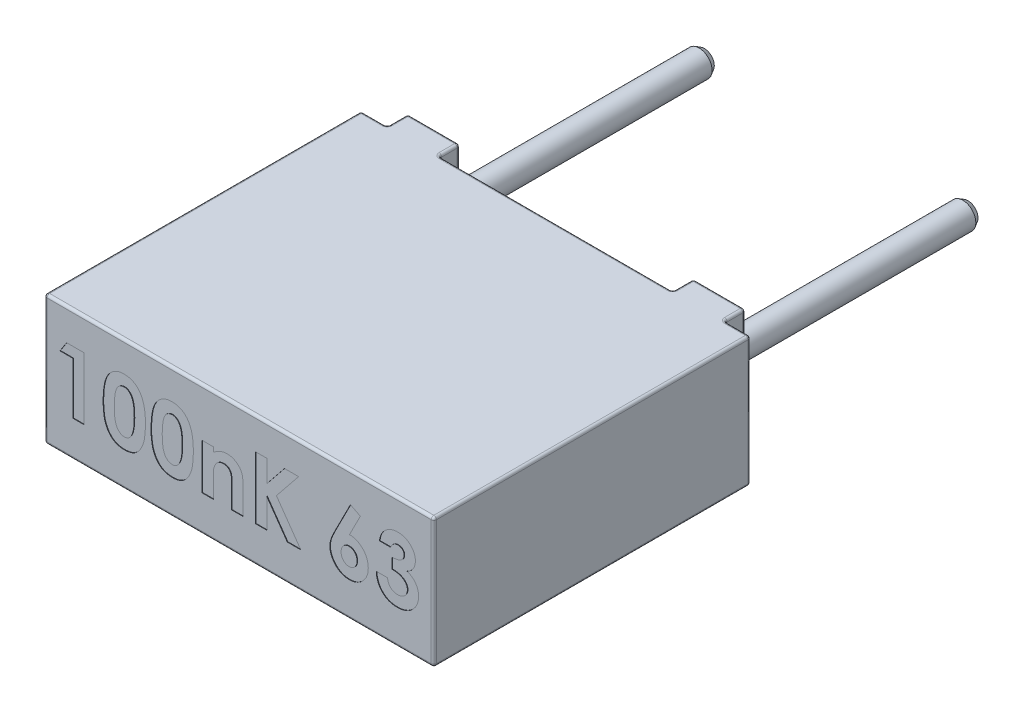
from build123d import *

# Parameters (mm, degrees)
CROQUIS1_W                = 7.5
CROQUIS1_H                = 2.5
SALIENTE_EXTRUIR1_DEPTH   = 6.5
CROQUIS2_W                = 0.5
CROQUIS2_H                = 0.4
CROQUIS2_W_2              = 4.5
CORTAR_EXTRUIR1_DEPTH     = 8.90964601
REDONDEO1_R               = 0.05
CROQUIS3_R                = 0.25
SALIENTE_EXTRUIR2_DEPTH   = 5
SALIENTE_EXTRUIR2_2_DEPTH = 5
CHAFL_N1_SIZE             = 0.1
CHAFL_N1_SIZE2            = 0.057735027
CHAFL_N2_SIZE             = 0.1
CHAFL_N2_SIZE2            = 0.057735027
CORTAR_EXTRUIR2_DEPTH     = 0.01


with BuildPart() as part:
    # Croquis1 → Saliente-Extruir1 (new body)
    with BuildSketch(Plane.XY):
        Rectangle(CROQUIS1_W, CROQUIS1_H)
    extrude(amount=SALIENTE_EXTRUIR1_DEPTH)

    # Croquis2 → Cortar-Extruir1 (cut, through all)
    with BuildSketch(Plane.XZ.offset(1.25)):
        with Locations((-3.5, 0.2)):
            Rectangle(CROQUIS2_W, CROQUIS2_H)
        with Locations((0, 0.2)):
            Rectangle(CROQUIS2_W_2, CROQUIS2_H)
        with Locations((3.5, 0.2)):
            Rectangle(CROQUIS2_W, CROQUIS2_H)
    extrude(amount=-CORTAR_EXTRUIR1_DEPTH, mode=Mode.SUBTRACT)

    # Redondeo1
    redondeo1_edges = [part.edges().sort_by_distance(p)[0] for p in [
        (-3.75, 0, 6.5),
        (0, -1.25, 6.5),
        (-2.75, -1.25, 0),
        (2.75, -1.25, 0),
        (2.75, 1.25, 0),
        (-2.75, 1.25, 0),
        (-3.5, 1.25, 0.4),
        (-3.75, 0, 0.4),
        (-3.25, 1.25, 0.2),
        (-3.25, 0, 0.4),
        (-3.25, 0, 0),
        (-3.25, -1.25, 0.2),
        (-3.5, -1.25, 0.4),
        (3.5, 1.25, 0.4),
        (3.25, 0, 0.4),
        (3.75, 0, 0.4),
        (3.25, 1.25, 0.2),
        (3.25, 0, 0),
        (3.5, -1.25, 0.4),
        (3.25, -1.25, 0.2),
        (-2.25, 1.25, 0.2),
        (-2.25, 0, 0),
        (0, 1.25, 0.4),
        (-2.25, 0, 0.4),
        (2.25, 1.25, 0.2),
        (2.25, 0, 0.4),
        (2.25, 0, 0),
        (-2.25, -1.25, 0.2),
        (3.75, 0, 6.5),
        (2.25, -1.25, 0.2),
        (0, -1.25, 0.4),
        (0, 1.25, 6.5),
        (3.75, -1.25, 3.45),
        (-3.75, -1.25, 3.45),
        (-3.75, 1.25, 3.45),
        (3.75, 1.25, 3.45),
    ]]
    fillet(redondeo1_edges, radius=REDONDEO1_R)

    # Croquis4 → Cortar-Extruir2 (cut)
    # profile 1 of 7: a face of its own
    with BuildSketch(Plane.XY.offset(6.5)):
        Polygon((-3.322811011, 0.642041721), (-2.989878319, 0.642041721), (-2.989878319, -0.557958279), (-3.205262934, -0.557958279), (-3.205262934, 0.442041721), (-3.45141678, 0.442041721), align=None)
    # profile 2 of 7: a face of its own
    with BuildSketch(Plane.XY.offset(6.5)):
        with BuildLine():
            add(Edge.make_bspline(
                [(-2.216561011, 0.672810952), (-2.206135502, 0.672656182), (-2.185636165, 0.672351864), (-2.1554445, 0.669055847), (-2.12636158, 0.664076485), (-2.098273628, 0.657132012), (-2.071382824, 0.647941249), (-2.045493451, 0.636940063), (-2.020913667, 0.62355142), (-1.997330003, 0.60842826), (-1.974751542, 0.591306698), (-1.953720942, 0.571787234), (-1.933854139, 0.550319011), (-1.915581177, 0.526577468), (-1.898497395, 0.50077856), (-1.882658927, 0.472918195), (-1.868187022, 0.442860016), (-1.854919483, 0.41054978), (-1.843055608, 0.375503172), (-1.833062681, 0.337318191), (-1.824492074, 0.295986116), (-1.817257877, 0.251404067), (-1.811789993, 0.203512783), (-1.808104529, 0.15234408), (-1.805575389, 0.097996605), (-1.805368979, 0.060714683), (-1.805262934, 0.041560952)],
                knots=[0, 0, 0, 0, 0.879237366, 1.728815576, 2.559023295, 3.367336655, 4.166867292, 4.954216142, 5.737608147, 6.525189134, 7.316157332, 8.124696809, 8.942788509, 9.781158001, 10.649253743, 11.551476218, 12.482711956, 13.461909668, 14.496590415, 15.601789533, 16.789733467, 18.056700938, 19.410929216, 20.8549011, 22.384193279, 24, 24, 24, 24], degree=3))
            add(Edge.make_bspline(
                [(-1.805262934, 0.041560952), (-1.80537754, 0.022167585), (-1.805600215, -0.015513377), (-1.807999392, -0.070357942), (-1.812130887, -0.12189816), (-1.817455857, -0.170128699), (-1.824749608, -0.21502409), (-1.833291604, -0.25670058), (-1.843442267, -0.295143064), (-1.855696934, -0.330264922), (-1.868884164, -0.362631902), (-1.883395657, -0.392631474), (-1.898978478, -0.420344896), (-1.915275204, -0.44619026), (-1.933179284, -0.46940566), (-1.951819273, -0.490780541), (-1.972006792, -0.509500704), (-1.992891867, -0.526530905), (-2.015239603, -0.541248416), (-2.038819533, -0.554120108), (-2.064052048, -0.564560579), (-2.090477201, -0.573641144), (-2.118545414, -0.580160009), (-2.147810687, -0.585332515), (-2.178603419, -0.588191158), (-2.199568351, -0.588545792), (-2.210311011, -0.58872751)],
                knots=[0, 0, 0, 0, 1.643780988, 3.193836972, 4.651895693, 6.025988579, 7.305620092, 8.505800249, 9.631074763, 10.672816429, 11.65661981, 12.592235626, 13.49536222, 14.350718032, 15.179365177, 15.97804903, 16.751647189, 17.51006938, 18.259804725, 19.016521909, 19.783502495, 20.571750527, 21.382245291, 22.22305063, 23.089471752, 24, 24, 24, 24], degree=3))
            add(Edge.make_bspline(
                [(-2.210311011, -0.58872751), (-2.221053381, -0.588542287), (-2.242097526, -0.588179437), (-2.272973525, -0.58535377), (-2.30239389, -0.580139055), (-2.330684167, -0.573591097), (-2.357647462, -0.564580671), (-2.383413063, -0.553827828), (-2.407782853, -0.541036449), (-2.430824311, -0.526284648), (-2.452458765, -0.509368392), (-2.473022415, -0.49046862), (-2.492469772, -0.469633239), (-2.510504995, -0.446628874), (-2.527423447, -0.421762586), (-2.543048697, -0.394750414), (-2.557371354, -0.365631687), (-2.570839433, -0.334365816), (-2.582541488, -0.300279684), (-2.592955775, -0.263068905), (-2.601486884, -0.222423296), (-2.608348173, -0.178355917), (-2.613826223, -0.130960124), (-2.617901262, -0.080213043), (-2.620313764, -0.026091035), (-2.620534105, 0.011109717), (-2.62064755, 0.030262875)],
                knots=[0, 0, 0, 0, 0.917216111, 1.796812873, 2.643793957, 3.46689424, 4.273913431, 5.068098542, 5.848489301, 6.620921603, 7.401012384, 8.190319798, 9.003608147, 9.831726257, 10.68377682, 11.569763213, 12.493818149, 13.453288342, 14.474581811, 15.568529029, 16.750744269, 18.018426408, 19.375425659, 20.823733699, 22.36466933, 24, 24, 24, 24], degree=3))
            add(Edge.make_bspline(
                [(-2.62064755, 0.030262875), (-2.620442056, 0.05687468), (-2.620045552, 0.108222501), (-2.615020768, 0.182405173), (-2.607645659, 0.250974203), (-2.596813372, 0.313814892), (-2.583419398, 0.371159983), (-2.566267717, 0.422631717), (-2.546741776, 0.468942321), (-2.530103166, 0.496377002), (-2.522089857, 0.509589798)],
                knots=[0, 0, 0, 0, 1.288568992, 2.486310467, 3.599230591, 4.627010532, 5.572937695, 6.447898582, 7.252493626, 8, 8, 8, 8], degree=3))
            add(Edge.make_bspline(
                [(-2.522089857, 0.509589798), (-2.512772364, 0.522570044), (-2.494554829, 0.547948983), (-2.462700959, 0.581266786), (-2.428478124, 0.609761803), (-2.391183404, 0.632789165), (-2.351406633, 0.650948545), (-2.308806306, 0.663774311), (-2.26353974, 0.6712472), (-2.232454433, 0.672281917), (-2.216561011, 0.672810952)],
                knots=[0, 0, 0, 0, 1.058512271, 2.069600068, 3.047294572, 4.004278952, 4.967380941, 5.939006123, 6.946246673, 8, 8, 8, 8], degree=3))
        make_face()
        with BuildLine():
            add(Edge.make_bspline(
                [(-2.21127255, 0.457426336), (-2.220697297, 0.456979622), (-2.239174803, 0.456103825), (-2.265986546, 0.448669543), (-2.291268346, 0.437186894), (-2.310499535, 0.423369322), (-2.324893889, 0.410123521), (-2.334951328, 0.398136503), (-2.344650142, 0.384759854), (-2.353216623, 0.369389956), (-2.361305618, 0.352579066), (-2.369211003, 0.334250874), (-2.375691344, 0.3139552), (-2.382058107, 0.292037681), (-2.387635985, 0.267892357), (-2.392309024, 0.241321866), (-2.396483973, 0.212153417), (-2.399396051, 0.180367906), (-2.40211098, 0.145998587), (-2.404057171, 0.108968899), (-2.404870824, 0.069288833), (-2.40512946, 0.04196176), (-2.405262934, 0.027859029)],
                knots=[0, 0, 0, 0, 1.076674018, 2.110852608, 3.161083442, 4.239746716, 4.804137807, 5.395870207, 6.026861976, 6.692161227, 7.405688833, 8.16177676, 8.973626916, 9.841385931, 10.773283133, 11.807421078, 12.927755683, 14.143907515, 15.458935494, 16.872852025, 18.386167141, 20, 20, 20, 20], degree=3))
            add(Edge.make_bspline(
                [(-2.405262934, 0.027859029), (-2.405043251, 0.009588258), (-2.404621993, -0.025447299), (-2.402415639, -0.075829649), (-2.397993186, -0.121681646), (-2.392492546, -0.163314043), (-2.384766674, -0.200456844), (-2.375877558, -0.233461455), (-2.36490029, -0.261907147), (-2.352213941, -0.286205308), (-2.338163238, -0.306875703), (-2.322910583, -0.324445632), (-2.306975272, -0.339660361), (-2.289859913, -0.352019098), (-2.271605339, -0.361490265), (-2.252363942, -0.368302758), (-2.232123493, -0.372472969), (-2.218263042, -0.373051243), (-2.21127255, -0.373342895)],
                knots=[0, 0, 0, 0, 1.771748488, 3.397459088, 4.888034009, 6.237357457, 7.467047327, 8.564189669, 9.548206622, 10.417051504, 11.216568818, 11.965764335, 12.669334354, 13.348544111, 14.005342236, 14.656555988, 15.322436492, 16, 16, 16, 16], degree=3))
            add(Edge.make_bspline(
                [(-2.21127255, -0.373342895), (-2.204521948, -0.373143325), (-2.191305111, -0.372752592), (-2.172032001, -0.368741776), (-2.15380598, -0.362221059), (-2.136682076, -0.352997047), (-2.12059904, -0.341267304), (-2.105635476, -0.326980285), (-2.091904235, -0.309993582), (-2.083904353, -0.297386937), (-2.079782165, -0.290890971)],
                knots=[0, 0, 0, 0, 0.992283464, 1.942767638, 2.88273346, 3.832339453, 4.79467288, 5.803907806, 6.868395428, 8, 8, 8, 8], degree=3))
            add(Edge.make_bspline(
                [(-2.079782165, -0.290890971), (-2.074928983, -0.282014443), (-2.064752255, -0.263401082), (-2.052975727, -0.23199173), (-2.043062903, -0.196567173), (-2.03453108, -0.157017164), (-2.028695833, -0.113185716), (-2.023670526, -0.065350766), (-2.021246695, -0.013271436), (-2.020852446, 0.022809311), (-2.02064755, 0.041560952)],
                knots=[0, 0, 0, 0, 0.710965849, 1.490837728, 2.352621235, 3.297892224, 4.334225155, 5.461620853, 6.680770821, 8, 8, 8, 8], degree=3))
            add(Edge.make_bspline(
                [(-2.02064755, 0.041560952), (-2.020726697, 0.060475366), (-2.020879041, 0.096882384), (-2.023674125, 0.149148942), (-2.027566492, 0.196885769), (-2.033259902, 0.239986286), (-2.040585509, 0.278555125), (-2.049614346, 0.312589762), (-2.060258674, 0.342157275), (-2.072881579, 0.36722818), (-2.08686223, 0.38853501), (-2.101703118, 0.406814617), (-2.117466996, 0.422421284), (-2.134127502, 0.435413743), (-2.152070248, 0.445340956), (-2.170952506, 0.452350389), (-2.190812986, 0.456590861), (-2.204360644, 0.457144086), (-2.21127255, 0.457426336)],
                knots=[0, 0, 0, 0, 1.793836731, 3.452829483, 4.963243077, 6.335886805, 7.574563692, 8.684454726, 9.672768357, 10.54971625, 11.340229787, 12.085688095, 12.778991901, 13.440269426, 14.083255152, 14.715733572, 15.344777694, 16, 16, 16, 16], degree=3))
        make_face(mode=Mode.SUBTRACT)
    # profile 3 of 7: a face of its own
    with BuildSketch(Plane.XY.offset(6.5)):
        with BuildLine():
            add(Edge.make_bspline(
                [(-1.293484088, 0.672810952), (-1.283058579, 0.672656182), (-1.262559242, 0.672351864), (-1.232367577, 0.669055847), (-1.203284657, 0.664076485), (-1.175196705, 0.657132012), (-1.148305901, 0.647941249), (-1.122416528, 0.636940063), (-1.097836744, 0.62355142), (-1.07425308, 0.60842826), (-1.051674619, 0.591306698), (-1.030644019, 0.571787234), (-1.010777216, 0.550319011), (-0.992504254, 0.526577468), (-0.975420472, 0.50077856), (-0.959582004, 0.472918195), (-0.945110099, 0.442860016), (-0.93184256, 0.41054978), (-0.919978685, 0.375503172), (-0.909985758, 0.337318191), (-0.901415151, 0.295986116), (-0.894180954, 0.251404067), (-0.88871307, 0.203512783), (-0.885027606, 0.15234408), (-0.882498466, 0.097996605), (-0.882292055, 0.060714683), (-0.882186011, 0.041560952)],
                knots=[0, 0, 0, 0, 0.879237366, 1.728815576, 2.559023295, 3.367336655, 4.166867292, 4.954216142, 5.737608147, 6.525189134, 7.316157332, 8.124696809, 8.942788509, 9.781158001, 10.649253743, 11.551476218, 12.482711956, 13.461909668, 14.496590415, 15.601789533, 16.789733467, 18.056700938, 19.410929216, 20.8549011, 22.384193279, 24, 24, 24, 24], degree=3))
            add(Edge.make_bspline(
                [(-0.882186011, 0.041560952), (-0.882300616, 0.022167585), (-0.882523292, -0.015513377), (-0.884922469, -0.070357942), (-0.889053964, -0.12189816), (-0.894378933, -0.170128699), (-0.901672685, -0.21502409), (-0.910214681, -0.25670058), (-0.920365344, -0.295143064), (-0.932620011, -0.330264922), (-0.945807241, -0.362631902), (-0.960318733, -0.392631474), (-0.975901554, -0.420344896), (-0.992198281, -0.44619026), (-1.010102361, -0.46940566), (-1.02874235, -0.490780541), (-1.048929869, -0.509500704), (-1.069814944, -0.526530905), (-1.09216268, -0.541248416), (-1.11574261, -0.554120108), (-1.140975125, -0.564560579), (-1.167400278, -0.573641144), (-1.19546849, -0.580160009), (-1.224733763, -0.585332515), (-1.255526496, -0.588191158), (-1.276491428, -0.588545792), (-1.287234088, -0.58872751)],
                knots=[0, 0, 0, 0, 1.643780988, 3.193836972, 4.651895693, 6.025988579, 7.305620092, 8.505800249, 9.631074763, 10.672816429, 11.65661981, 12.592235626, 13.49536222, 14.350718032, 15.179365177, 15.97804903, 16.751647189, 17.51006938, 18.259804725, 19.016521909, 19.783502495, 20.571750527, 21.382245291, 22.22305063, 23.089471752, 24, 24, 24, 24], degree=3))
            add(Edge.make_bspline(
                [(-1.287234088, -0.58872751), (-1.297976458, -0.588542287), (-1.319020603, -0.588179437), (-1.349896602, -0.58535377), (-1.379316966, -0.580139055), (-1.407607244, -0.573591097), (-1.434570539, -0.564580671), (-1.460336139, -0.553827828), (-1.48470593, -0.541036449), (-1.507747388, -0.526284648), (-1.529381842, -0.509368392), (-1.549945491, -0.49046862), (-1.569392849, -0.469633239), (-1.587428071, -0.446628874), (-1.604346524, -0.421762586), (-1.619971774, -0.394750414), (-1.634294431, -0.365631687), (-1.64776251, -0.334365816), (-1.659464565, -0.300279684), (-1.669878852, -0.263068905), (-1.678409961, -0.222423296), (-1.68527125, -0.178355917), (-1.6907493, -0.130960124), (-1.694824339, -0.080213043), (-1.697236841, -0.026091035), (-1.697457182, 0.011109717), (-1.697570627, 0.030262875)],
                knots=[0, 0, 0, 0, 0.917216111, 1.796812873, 2.643793957, 3.46689424, 4.273913431, 5.068098542, 5.848489301, 6.620921603, 7.401012384, 8.190319798, 9.003608147, 9.831726257, 10.68377682, 11.569763213, 12.493818149, 13.453288342, 14.474581811, 15.568529029, 16.750744269, 18.018426408, 19.375425659, 20.823733699, 22.36466933, 24, 24, 24, 24], degree=3))
            add(Edge.make_bspline(
                [(-1.697570627, 0.030262875), (-1.697365132, 0.05687468), (-1.696968629, 0.108222501), (-1.691943845, 0.182405173), (-1.684568736, 0.250974203), (-1.673736449, 0.313814892), (-1.660342475, 0.371159983), (-1.643190794, 0.422631717), (-1.623664853, 0.468942321), (-1.607026243, 0.496377002), (-1.599012934, 0.509589798)],
                knots=[0, 0, 0, 0, 1.288568992, 2.486310467, 3.599230591, 4.627010532, 5.572937695, 6.447898582, 7.252493626, 8, 8, 8, 8], degree=3))
            add(Edge.make_bspline(
                [(-1.599012934, 0.509589798), (-1.589695441, 0.522570044), (-1.571477906, 0.547948983), (-1.539624036, 0.581266786), (-1.5054012, 0.609761803), (-1.468106481, 0.632789165), (-1.42832971, 0.650948545), (-1.385729383, 0.663774311), (-1.340462816, 0.6712472), (-1.30937751, 0.672281917), (-1.293484088, 0.672810952)],
                knots=[0, 0, 0, 0, 1.058512271, 2.069600068, 3.047294572, 4.004278952, 4.967380941, 5.939006123, 6.946246673, 8, 8, 8, 8], degree=3))
        make_face()
        with BuildLine():
            add(Edge.make_bspline(
                [(-1.288195627, 0.457426336), (-1.297620373, 0.456979622), (-1.31609788, 0.456103825), (-1.342909623, 0.448669543), (-1.368191423, 0.437186894), (-1.387422612, 0.423369322), (-1.401816966, 0.410123521), (-1.411874405, 0.398136503), (-1.421573219, 0.384759854), (-1.4301397, 0.369389956), (-1.438228695, 0.352579066), (-1.44613408, 0.334250874), (-1.452614421, 0.3139552), (-1.458981183, 0.292037681), (-1.464559062, 0.267892357), (-1.469232101, 0.241321866), (-1.47340705, 0.212153417), (-1.476319128, 0.180367906), (-1.479034057, 0.145998587), (-1.480980248, 0.108968899), (-1.481793901, 0.069288833), (-1.482052537, 0.04196176), (-1.482186011, 0.027859029)],
                knots=[0, 0, 0, 0, 1.076674018, 2.110852608, 3.161083442, 4.239746716, 4.804137807, 5.395870207, 6.026861976, 6.692161227, 7.405688833, 8.16177676, 8.973626916, 9.841385931, 10.773283133, 11.807421078, 12.927755683, 14.143907515, 15.458935494, 16.872852025, 18.386167141, 20, 20, 20, 20], degree=3))
            add(Edge.make_bspline(
                [(-1.482186011, 0.027859029), (-1.481966328, 0.009588258), (-1.48154507, -0.025447299), (-1.479338716, -0.075829649), (-1.474916263, -0.121681646), (-1.469415623, -0.163314043), (-1.461689751, -0.200456844), (-1.452800635, -0.233461455), (-1.441823366, -0.261907147), (-1.429137018, -0.286205308), (-1.415086315, -0.306875703), (-1.399833659, -0.324445632), (-1.383898349, -0.339660361), (-1.36678299, -0.352019098), (-1.348528416, -0.361490265), (-1.329287019, -0.368302758), (-1.30904657, -0.372472969), (-1.295186119, -0.373051243), (-1.288195627, -0.373342895)],
                knots=[0, 0, 0, 0, 1.771748488, 3.397459088, 4.888034009, 6.237357457, 7.467047327, 8.564189669, 9.548206622, 10.417051504, 11.216568818, 11.965764335, 12.669334354, 13.348544111, 14.005342236, 14.656555988, 15.322436492, 16, 16, 16, 16], degree=3))
            add(Edge.make_bspline(
                [(-1.288195627, -0.373342895), (-1.281445025, -0.373143325), (-1.268228188, -0.372752592), (-1.248955078, -0.368741776), (-1.230729057, -0.362221059), (-1.213605153, -0.352997047), (-1.197522117, -0.341267304), (-1.182558553, -0.326980285), (-1.168827312, -0.309993582), (-1.16082743, -0.297386937), (-1.156705242, -0.290890971)],
                knots=[0, 0, 0, 0, 0.992283464, 1.942767638, 2.88273346, 3.832339453, 4.79467288, 5.803907806, 6.868395428, 8, 8, 8, 8], degree=3))
            add(Edge.make_bspline(
                [(-1.156705242, -0.290890971), (-1.15185206, -0.282014443), (-1.141675332, -0.263401082), (-1.129898804, -0.23199173), (-1.11998598, -0.196567173), (-1.111454157, -0.157017164), (-1.10561891, -0.113185716), (-1.100593603, -0.065350766), (-1.098169772, -0.013271436), (-1.097775523, 0.022809311), (-1.097570627, 0.041560952)],
                knots=[0, 0, 0, 0, 0.710965849, 1.490837728, 2.352621235, 3.297892224, 4.334225155, 5.461620853, 6.680770821, 8, 8, 8, 8], degree=3))
            add(Edge.make_bspline(
                [(-1.097570627, 0.041560952), (-1.097649774, 0.060475366), (-1.097802118, 0.096882384), (-1.100597202, 0.149148942), (-1.104489569, 0.196885769), (-1.110182979, 0.239986286), (-1.117508586, 0.278555125), (-1.126537423, 0.312589762), (-1.137181751, 0.342157275), (-1.149804656, 0.36722818), (-1.163785307, 0.38853501), (-1.178626195, 0.406814617), (-1.194390073, 0.422421284), (-1.211050579, 0.435413743), (-1.228993325, 0.445340956), (-1.247875583, 0.452350389), (-1.267736063, 0.456590861), (-1.281283721, 0.457144086), (-1.288195627, 0.457426336)],
                knots=[0, 0, 0, 0, 1.793836731, 3.452829483, 4.963243077, 6.335886805, 7.574563692, 8.684454726, 9.672768357, 10.54971625, 11.340229787, 12.085688095, 12.778991901, 13.440269426, 14.083255152, 14.715733572, 15.344777694, 16, 16, 16, 16], degree=3))
        make_face(mode=Mode.SUBTRACT)
    # profile 4 of 7: a face of its own
    with BuildSketch(Plane.XY.offset(6.5)):
        with BuildLine():
            Line((-0.712955242, 0.318964798), (-0.497570627, 0.318964798))
            Line((-0.497570627, 0.318964798), (-0.497570627, 0.226176336))
            add(Edge.make_bspline(
                [(-0.497570627, 0.226176336), (-0.485283041, 0.235733873), (-0.461799076, 0.254000185), (-0.426099396, 0.277289825), (-0.392403317, 0.29635146), (-0.359959718, 0.310850715), (-0.328158173, 0.321282306), (-0.296483633, 0.328776781), (-0.264464398, 0.3335757), (-0.2429397, 0.334091647), (-0.232186011, 0.334349413)],
                knots=[0, 0, 0, 0, 1.276643801, 2.439914479, 3.493451431, 4.44993799, 5.350072675, 6.235028322, 7.118224225, 8, 8, 8, 8], degree=3))
            add(Edge.make_bspline(
                [(-0.232186011, 0.334349413), (-0.221277841, 0.33405484), (-0.199864185, 0.333476568), (-0.168333758, 0.329432024), (-0.138209497, 0.322065629), (-0.10915268, 0.312285049), (-0.081459055, 0.299375244), (-0.054789358, 0.284046945), (-0.029716445, 0.26537604), (-0.014275436, 0.251157175), (-0.006464857, 0.243964798)],
                knots=[0, 0, 0, 0, 1.048836932, 2.058954983, 3.049370783, 4.026390553, 5.001981509, 5.982488534, 6.97947532, 8, 8, 8, 8], degree=3))
            add(Edge.make_bspline(
                [(-0.006464857, 0.243964798), (-0.000200486, 0.237299568), (0.012374104, 0.223920326), (0.028197647, 0.201025016), (0.041776026, 0.176064939), (0.05290162, 0.148752169), (0.061122987, 0.118936643), (0.067447796, 0.086978489), (0.070996757, 0.052698765), (0.071434893, 0.029148917), (0.071660143, 0.017041721)],
                knots=[0, 0, 0, 0, 0.889584746, 1.785680191, 2.700364693, 3.65222533, 4.649950538, 5.707241244, 6.821271309, 8, 8, 8, 8], degree=3))
            Line((0.071660143, 0.017041721), (0.071660143, -0.557958279))
            Line((0.071660143, -0.557958279), (-0.143724473, -0.557958279))
            Line((-0.143724473, -0.557958279), (-0.143724473, -0.177189048))
            add(Edge.make_bspline(
                [(-0.143724473, -0.177189048), (-0.143770022, -0.164769019), (-0.143857308, -0.140968339), (-0.144527474, -0.106905989), (-0.145836029, -0.076143263), (-0.147028743, -0.048624152), (-0.149370514, -0.024446366), (-0.151482361, -0.003456843), (-0.154722786, 0.014154), (-0.158939104, 0.033097104), (-0.166301834, 0.053379161), (-0.177732113, 0.074749659), (-0.192233025, 0.092904373), (-0.209212294, 0.107970577), (-0.228651169, 0.119889327), (-0.250314759, 0.12827491), (-0.274086921, 0.133501011), (-0.290651084, 0.134059417), (-0.299253319, 0.134349413)],
                knots=[0, 0, 0, 0, 1.49886392, 2.872294502, 4.110984203, 5.214877267, 6.195405875, 7.042225351, 7.75923308, 8.355011229, 9.382752534, 10.352059385, 11.267231453, 12.171456522, 13.078624015, 14.003401117, 14.963110155, 16, 16, 16, 16], degree=3))
            add(Edge.make_bspline(
                [(-0.299253319, 0.134349413), (-0.310440887, 0.133782089), (-0.332325946, 0.132672291), (-0.363978305, 0.124303408), (-0.393050469, 0.110070401), (-0.419304895, 0.090374782), (-0.442491531, 0.066058099), (-0.461588661, 0.037057666), (-0.47725223, 0.004073405), (-0.483987797, -0.020010463), (-0.487474473, -0.03247751)],
                knots=[0, 0, 0, 0, 0.984188326, 1.925263693, 2.85911992, 3.81709677, 4.80007086, 5.801799564, 6.862098548, 8, 8, 8, 8], degree=3))
            add(Edge.make_bspline(
                [(-0.487474473, -0.03247751), (-0.48834105, -0.03639287), (-0.490273692, -0.045124909), (-0.491863046, -0.059876735), (-0.494073952, -0.077378348), (-0.494902324, -0.097946478), (-0.496342772, -0.121483785), (-0.496875518, -0.148021409), (-0.497409218, -0.177507312), (-0.497515041, -0.198102095), (-0.497570627, -0.208919818)],
                knots=[0, 0, 0, 0, 0.543362196, 1.211806945, 2.009705693, 2.934833164, 4.000995085, 5.207458376, 6.533175157, 8, 8, 8, 8], degree=3))
            Line((-0.497570627, -0.208919818), (-0.497570627, -0.557958279))
            Line((-0.497570627, -0.557958279), (-0.712955242, -0.557958279))
            Line((-0.712955242, -0.557958279), (-0.712955242, 0.318964798))
        make_face()
    # profile 5 of 7: a face of its own
    with BuildSketch(Plane.XY.offset(6.5)):
        Polygon((0.317813989, 0.642041721), (0.533198604, 0.642041721), (0.533198604, 0.219685952), (0.87358322, 0.642041721), (1.14545822, 0.642041721), (0.717813989, 0.11127249), (1.187044758, -0.557958279), (0.927669758, -0.557958279), (0.533198604, 0.004782105), (0.533198604, -0.557958279), (0.317813989, -0.557958279), align=None)
    # profile 6 of 7: a face of its own
    with BuildSketch(Plane.XY.offset(6.5)):
        with BuildLine():
            Line((2.143775527, 0.672810952), (2.334400527, 0.576176336))
            Line((2.334400527, 0.576176336), (2.125265912, 0.165118644))
            add(Edge.make_bspline(
                [(2.125265912, 0.165118644), (2.137621389, 0.164798754), (2.161957527, 0.164168679), (2.197763215, 0.159076309), (2.23199412, 0.150272821), (2.26499539, 0.138603822), (2.296363616, 0.122932241), (2.326604, 0.104290077), (2.354934208, 0.081553953), (2.382003829, 0.056363534), (2.406618095, 0.028456169), (2.427999937, -0.00153118), (2.446633835, -0.032868918), (2.461119078, -0.066258147), (2.472803356, -0.101145403), (2.481234078, -0.137670143), (2.48604404, -0.175938137), (2.486707174, -0.201935319), (2.487044758, -0.215169818)],
                knots=[0, 0, 0, 0, 1.013260694, 1.995783107, 2.958651975, 3.908806537, 4.861209129, 5.829647963, 6.817170299, 7.835534541, 8.860094905, 9.863329007, 10.853101798, 11.844815043, 12.84250023, 13.867713965, 14.914507806, 16, 16, 16, 16], degree=3))
            add(Edge.make_bspline(
                [(2.487044758, -0.215169818), (2.486728414, -0.227927072), (2.486103136, -0.253142693), (2.480934392, -0.290178028), (2.472581429, -0.325711266), (2.460643368, -0.359671442), (2.445469127, -0.392224556), (2.426912058, -0.423351505), (2.404818267, -0.452819686), (2.379758595, -0.480472521), (2.35236405, -0.505678285), (2.323488708, -0.528082634), (2.292887883, -0.546589477), (2.261139965, -0.56221894), (2.227660457, -0.573881905), (2.19295038, -0.582685423), (2.156746519, -0.587765435), (2.132172266, -0.588404252), (2.119737066, -0.58872751)],
                knots=[0, 0, 0, 0, 1.049934834, 2.075270938, 3.072134561, 4.05064612, 5.033440221, 6.024524368, 7.028587226, 8.060776465, 9.092543989, 10.090062252, 11.064205434, 12.031961459, 12.998029633, 13.977230324, 14.976426867, 16, 16, 16, 16], degree=3))
            add(Edge.make_bspline(
                [(2.119737066, -0.58872751), (2.106733625, -0.588462229), (2.081164119, -0.587940591), (2.043749533, -0.582099616), (2.007865724, -0.573306843), (1.973714366, -0.560752256), (1.941083082, -0.544766372), (1.910356046, -0.524985448), (1.881274425, -0.501627615), (1.854148273, -0.475218387), (1.829709631, -0.446290691), (1.807912405, -0.416256212), (1.789471924, -0.385067817), (1.774544784, -0.352758854), (1.762898283, -0.319432277), (1.754794694, -0.285024835), (1.749514458, -0.249627792), (1.748895471, -0.225605356), (1.74858322, -0.213487125)],
                knots=[0, 0, 0, 0, 1.063775006, 2.091769615, 3.092589432, 4.084662827, 5.064601646, 6.061867366, 7.070035304, 8.113879863, 9.156342271, 10.166834137, 11.149076039, 12.117706134, 13.076241869, 14.034148791, 15.008317125, 16, 16, 16, 16], degree=3))
            add(Edge.make_bspline(
                [(1.74858322, -0.213487125), (1.748748207, -0.204102973), (1.7490791, -0.185282433), (1.752404377, -0.157099697), (1.757459965, -0.128842984), (1.763320055, -0.104999074), (1.769354183, -0.084836554), (1.775427579, -0.067773557), (1.782954215, -0.048837362), (1.791558275, -0.027979613), (1.801510325, -0.005225402), (1.812758378, 0.019363249), (1.825330437, 0.045972544), (1.834296046, 0.06424901), (1.838967835, 0.07377249)],
                knots=[0, 0, 0, 0, 1.110454016, 2.227089276, 3.35462975, 4.507227546, 5.131400587, 5.845402449, 6.650387134, 7.543487832, 8.516250726, 9.590168902, 10.744287919, 12, 12, 12, 12], degree=3))
            Line((1.838967835, 0.07377249), (2.143775527, 0.672810952))
        make_face()
        with BuildLine():
            add(Edge.make_bspline(
                [(2.114929373, -0.034881356), (2.104594564, -0.035355392), (2.084370699, -0.036283018), (2.055615387, -0.045997569), (2.029397066, -0.061237281), (2.006670702, -0.082461528), (1.987662189, -0.107825336), (1.973694067, -0.136756147), (1.965291465, -0.168867888), (1.964418489, -0.191319881), (1.963967835, -0.202910202)],
                knots=[0, 0, 0, 0, 0.981744412, 1.921144944, 2.858899012, 3.85339082, 4.86292663, 5.863643845, 6.897155691, 8, 8, 8, 8], degree=3))
            add(Edge.make_bspline(
                [(1.963967835, -0.202910202), (1.964501423, -0.214504383), (1.965539288, -0.237055839), (1.974257839, -0.26947334), (1.988532811, -0.299061137), (2.00855255, -0.324761071), (2.032055435, -0.346094005), (2.058117347, -0.361870731), (2.086303565, -0.371562891), (2.105800659, -0.372745463), (2.115650527, -0.373342895)],
                knots=[0, 0, 0, 0, 1.098279937, 2.136227893, 3.159405121, 4.194678092, 5.206500211, 6.154139736, 7.067477469, 8, 8, 8, 8], degree=3))
            add(Edge.make_bspline(
                [(2.115650527, -0.373342895), (2.126053101, -0.372734822), (2.146454356, -0.371542287), (2.175884503, -0.362257955), (2.202769119, -0.346745542), (2.22654032, -0.325480906), (2.24695933, -0.300074243), (2.261087223, -0.270312652), (2.270208836, -0.237661173), (2.271165527, -0.214753574), (2.271660143, -0.202910202)],
                knots=[0, 0, 0, 0, 0.96921794, 1.900804717, 2.848419905, 3.844199796, 4.861108892, 5.867439427, 6.897452859, 8, 8, 8, 8], degree=3))
            add(Edge.make_bspline(
                [(2.271660143, -0.202910202), (2.271096685, -0.191326649), (2.270005484, -0.168893745), (2.261809271, -0.136631568), (2.247175487, -0.107812267), (2.227736891, -0.08235683), (2.204228406, -0.061142047), (2.176960775, -0.045877384), (2.146891872, -0.036300229), (2.125738878, -0.035361209), (2.114929373, -0.034881356)],
                knots=[0, 0, 0, 0, 1.083229974, 2.097801324, 3.086792542, 4.086858909, 5.079819718, 6.026392613, 6.991456328, 8, 8, 8, 8], degree=3))
        make_face(mode=Mode.SUBTRACT)
    # profile 7 of 7: a face of its own
    with BuildSketch(Plane.XY.offset(6.5)):
        with BuildLine():
            Line((2.917813989, 0.349734029), (2.702429373, 0.349734029))
            add(Edge.make_bspline(
                [(2.702429373, 0.349734029), (2.703950071, 0.360500337), (2.706931297, 0.381606972), (2.714064973, 0.412164121), (2.722597619, 0.441149668), (2.733250192, 0.468471822), (2.745743927, 0.494179253), (2.759951776, 0.518360175), (2.776027333, 0.540910801), (2.788349417, 0.554495387), (2.794496681, 0.56127249)],
                knots=[0, 0, 0, 0, 1.111473889, 2.178970933, 3.205615836, 4.199322666, 5.174200091, 6.12565194, 7.064921805, 8, 8, 8, 8], degree=3))
            add(Edge.make_bspline(
                [(2.794496681, 0.56127249), (2.803363295, 0.570214387), (2.820838459, 0.587837925), (2.850041507, 0.610411732), (2.880651695, 0.629947826), (2.913282923, 0.645436183), (2.947427425, 0.657972213), (2.98335673, 0.666392693), (3.020924017, 0.671979756), (3.046558964, 0.672530101), (3.059640912, 0.672810952)],
                knots=[0, 0, 0, 0, 1.01925491, 2.00884431, 2.983262333, 3.955970413, 4.92937149, 5.924503185, 6.940838805, 8, 8, 8, 8], degree=3))
            add(Edge.make_bspline(
                [(3.059640912, 0.672810952), (3.071271437, 0.672536378), (3.094134705, 0.671996621), (3.127737957, 0.667663745), (3.159775845, 0.660064363), (3.19058702, 0.650128341), (3.219718349, 0.636608724), (3.247812789, 0.620915325), (3.274085381, 0.601666719), (3.298597597, 0.579917732), (3.321116743, 0.556394073), (3.340618422, 0.531249217), (3.357384365, 0.505154839), (3.371197285, 0.477894146), (3.381817543, 0.449421009), (3.389188317, 0.419899913), (3.394012668, 0.389395999), (3.394493299, 0.368662899), (3.394737066, 0.35814749)],
                knots=[0, 0, 0, 0, 1.091422571, 2.145516843, 3.172569842, 4.178562979, 5.178154469, 6.181868002, 7.194278174, 8.227918432, 9.254613415, 10.245994977, 11.209837596, 12.161663635, 13.10878368, 14.055455738, 15.013766427, 16, 16, 16, 16], degree=3))
            add(Edge.make_bspline(
                [(3.394737066, 0.35814749), (3.394236842, 0.345125031), (3.393252056, 0.319487814), (3.385171172, 0.281965841), (3.372522391, 0.246088139), (3.354249996, 0.21235669), (3.331404849, 0.180863294), (3.303374619, 0.152660868), (3.270957679, 0.127307237), (3.24662185, 0.113682192), (3.234160143, 0.106705182)],
                knots=[0, 0, 0, 0, 0.992805628, 1.954529043, 2.915727527, 3.886831945, 4.871318353, 5.87440735, 6.911542536, 8, 8, 8, 8], degree=3))
            add(Edge.make_bspline(
                [(3.234160143, 0.106705182), (3.242713668, 0.10389688), (3.259520961, 0.098378692), (3.283410507, 0.087510683), (3.306126735, 0.07563375), (3.327278481, 0.061835885), (3.347076123, 0.046675013), (3.365398974, 0.030021532), (3.382356507, 0.011911755), (3.397671899, -0.007753914), (3.411264907, -0.028660963), (3.423461189, -0.05032645), (3.43349941, -0.073078936), (3.442003032, -0.096658573), (3.448477206, -0.121277282), (3.453035603, -0.146839667), (3.455670468, -0.173287419), (3.45607233, -0.191205755), (3.456275527, -0.200265971)],
                knots=[0, 0, 0, 0, 1.059543567, 2.081955587, 3.086750234, 4.076226789, 5.052108497, 6.020845489, 6.989030705, 7.970690546, 8.952259656, 9.923888338, 10.895517021, 11.877585046, 12.873342345, 13.889638361, 14.932918083, 16, 16, 16, 16], degree=3))
            add(Edge.make_bspline(
                [(3.456275527, -0.200265971), (3.455863619, -0.213580811), (3.455051421, -0.239834962), (3.449887841, -0.278504639), (3.440274187, -0.315372741), (3.427626892, -0.350863491), (3.410756773, -0.384518715), (3.39090348, -0.417110756), (3.366499793, -0.44750933), (3.339379286, -0.476518097), (3.309260381, -0.502891569), (3.276606589, -0.525756183), (3.242135937, -0.545378089), (3.205630341, -0.561307712), (3.167102482, -0.573575343), (3.126638237, -0.582442953), (3.084067585, -0.587868303), (3.055009784, -0.588437048), (3.040169758, -0.58872751)],
                knots=[0, 0, 0, 0, 1.005138573, 1.981928558, 2.936866704, 3.876260664, 4.820238198, 5.773547, 6.751179199, 7.756627054, 8.768222608, 9.766606018, 10.760583154, 11.757261445, 12.767156078, 13.807575856, 14.880313354, 16, 16, 16, 16], degree=3))
            add(Edge.make_bspline(
                [(3.040169758, -0.58872751), (3.026131333, -0.588421267), (2.99868105, -0.587822449), (2.958529266, -0.582639374), (2.920368796, -0.574278654), (2.884102254, -0.562493525), (2.849869951, -0.547210228), (2.817361458, -0.52901125), (2.787225472, -0.506846917), (2.75912622, -0.481717768), (2.733687029, -0.45352429), (2.710950382, -0.422919571), (2.691417628, -0.389787233), (2.675008661, -0.354268832), (2.661851764, -0.316302057), (2.651473642, -0.275964116), (2.644224354, -0.233176201), (2.642016568, -0.203737206), (2.640890912, -0.18872751)],
                knots=[0, 0, 0, 0, 1.066544725, 2.085487077, 3.070979577, 4.031932826, 4.977951092, 5.916076795, 6.857635327, 7.814973522, 8.776389752, 9.738577119, 10.707772778, 11.69409279, 12.707140348, 13.757286496, 14.856535458, 16, 16, 16, 16], degree=3))
            Line((2.640890912, -0.18872751), (2.856275527, -0.18872751))
            add(Edge.make_bspline(
                [(2.856275527, -0.18872751), (2.857640397, -0.196274582), (2.860298839, -0.210974484), (2.865483967, -0.232256675), (2.872240912, -0.251901451), (2.880053622, -0.270083415), (2.888492525, -0.28704129), (2.898688737, -0.30214878), (2.909895135, -0.315816115), (2.926066048, -0.332063993), (2.949183482, -0.34875801), (2.980399677, -0.363265905), (3.015124738, -0.371769313), (3.039401019, -0.372806703), (3.051948604, -0.373342895)],
                knots=[0, 0, 0, 0, 0.928156231, 1.807827665, 2.648129825, 3.438902246, 4.202261636, 4.936546065, 5.639352463, 6.338805438, 7.70633318, 9.064371875, 10.482673459, 12, 12, 12, 12], degree=3))
            add(Edge.make_bspline(
                [(3.051948604, -0.373342895), (3.058606797, -0.373228718), (3.071648706, -0.373005071), (3.090805329, -0.370526242), (3.109054709, -0.36644361), (3.126430838, -0.360895464), (3.143044332, -0.353940516), (3.158577775, -0.344972527), (3.173347776, -0.334545959), (3.187193772, -0.322823729), (3.199987758, -0.310050695), (3.210633106, -0.295906729), (3.220362185, -0.281533932), (3.227557881, -0.265991985), (3.233862861, -0.25011721), (3.237721831, -0.233333403), (3.240635631, -0.215992642), (3.240804969, -0.204125387), (3.240890912, -0.19810251)],
                knots=[0, 0, 0, 0, 1.110435564, 2.175094844, 3.216326037, 4.226890168, 5.215276772, 6.21526065, 7.213097102, 8.228249917, 9.239874822, 10.221364777, 11.178138315, 12.128914389, 13.072518965, 14.022636769, 14.996447288, 16, 16, 16, 16], degree=3))
            add(Edge.make_bspline(
                [(3.240890912, -0.19810251), (3.24066275, -0.191515468), (3.240208532, -0.178402175), (3.236497525, -0.159266083), (3.23063706, -0.140858704), (3.222496158, -0.123261555), (3.211624891, -0.106539497), (3.198796917, -0.090357033), (3.183001605, -0.075556433), (3.165672031, -0.060926487), (3.145576534, -0.048173588), (3.123693792, -0.036404535), (3.099448692, -0.027040002), (3.07343308, -0.01867574), (3.045154845, -0.012566613), (3.014789585, -0.008130792), (2.982386284, -0.00482901), (2.960050267, -0.004355315), (2.94858322, -0.004112125)],
                knots=[0, 0, 0, 0, 0.809814727, 1.612155564, 2.388397, 3.182215007, 3.988903953, 4.837162975, 5.715530372, 6.646997145, 7.623086902, 8.637258368, 9.698941581, 10.815059213, 11.996518529, 13.252603015, 14.589518788, 16, 16, 16, 16], degree=3))
            Line((2.94858322, -0.004112125), (2.94858322, 0.195887875))
            add(Edge.make_bspline(
                [(2.94858322, 0.195887875), (2.962860376, 0.197103763), (2.989570108, 0.199378449), (3.026644648, 0.204697882), (3.057856631, 0.21180818), (3.083956239, 0.220386369), (3.105627681, 0.231402999), (3.124559733, 0.243564872), (3.140864911, 0.25768911), (3.154644975, 0.273354531), (3.165668596, 0.290177723), (3.173470474, 0.307897206), (3.178622426, 0.325964716), (3.179110573, 0.338322348), (3.17935245, 0.344445567)],
                knots=[0, 0, 0, 0, 1.70044513, 3.18119609, 4.440695891, 5.496282586, 6.431922213, 7.318171381, 8.16090191, 8.983045123, 9.787564368, 10.536848927, 11.275007137, 12, 12, 12, 12], degree=3))
            add(Edge.make_bspline(
                [(3.17935245, 0.344445567), (3.178935143, 0.35225813), (3.178120646, 0.367506599), (3.171794827, 0.389330371), (3.160813921, 0.408784454), (3.146090454, 0.425827913), (3.128149397, 0.440063887), (3.107119334, 0.450398961), (3.083456618, 0.456471279), (3.066808622, 0.457100774), (3.058198604, 0.457426336)],
                knots=[0, 0, 0, 0, 1.009664648, 1.970651636, 2.907870547, 3.878035693, 4.867062054, 5.849714035, 6.887914197, 8, 8, 8, 8], degree=3))
            add(Edge.make_bspline(
                [(3.058198604, 0.457426336), (3.050394591, 0.457042207), (3.03490904, 0.456279977), (3.012264528, 0.450590892), (2.990759786, 0.441014026), (2.970840117, 0.427808091), (2.952793064, 0.411948324), (2.937981641, 0.393165722), (2.925662201, 0.372585583), (2.920440315, 0.357381075), (2.917813989, 0.349734029)],
                knots=[0, 0, 0, 0, 0.98818071, 1.960853194, 2.938124878, 3.957524365, 4.978590984, 5.968022688, 6.978025184, 8, 8, 8, 8], degree=3))
        make_face()
    extrude(amount=-CORTAR_EXTRUIR2_DEPTH, mode=Mode.SUBTRACT)


with BuildPart() as body_2:
    # Croquis3 → Saliente-Extruir2 (new body)
    with BuildSketch(Plane(origin=(0, 0, 0), x_dir=(-1, 0, 0), z_dir=(0, 0, -1))):
        with Locations((-2.54, 0)):
            Circle(CROQUIS3_R)
    extrude(amount=SALIENTE_EXTRUIR2_DEPTH)

    # Chaflán1
    chafl_n1_edges = [body_2.edges().sort_by_distance(p)[0] for p in [
        (2.79, 0, -5),
    ]]
    chafl_n1_side = [body_2.faces().sort_by_distance(p)[0] for p in [
        (2.79, 0, -2.5),
    ]]
    chamfer(chafl_n1_edges, length=CHAFL_N1_SIZE, length2=CHAFL_N1_SIZE2, reference=chafl_n1_side[0])


with BuildPart() as body_3:
    # Croquis3 → Saliente-Extruir2 2 (new body)
    with BuildSketch(Plane(origin=(0, 0, 0), x_dir=(-1, 0, 0), z_dir=(0, 0, -1))):
        with Locations((2.54, 0)):
            Circle(CROQUIS3_R)
    extrude(amount=SALIENTE_EXTRUIR2_2_DEPTH)

    # Chaflán2
    chafl_n2_edges = [body_3.edges().sort_by_distance(p)[0] for p in [
        (-2.29, 0, -5),
    ]]
    chafl_n2_side = [body_3.faces().sort_by_distance(p)[0] for p in [
        (-2.29, 0, -2.5),
    ]]
    chamfer(chafl_n2_edges, length=CHAFL_N2_SIZE, length2=CHAFL_N2_SIZE2, reference=chafl_n2_side[0])


solid = Compound([part.part, body_2.part, body_3.part])
